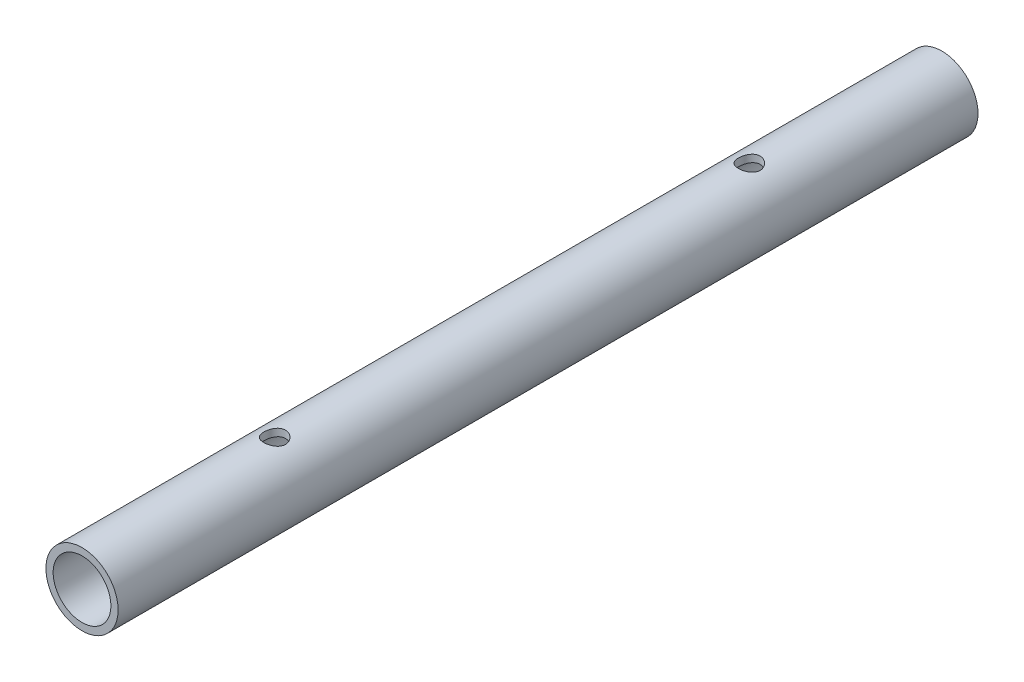
from build123d import *

# Parameters (mm, degrees)
SKETCH1_R               = 5
BOSS_EXTRUDE1_DEPTH     = 119.147
CUT_EXTRUDE1_REACH      = 121.357
SKETCH2_R               = 4
CUT_EXTRUDE2_DEPTH      = 120.356640406
CUT_EXTRUDE2_DEPTH_BACK = 120.356640406
SKETCH5_R               = 1.5


with BuildPart() as part:
    # Sketch1 → Boss-Extrude1 (new body)
    with BuildSketch(Plane.XY):
        Circle(SKETCH1_R)
    extrude(amount=BOSS_EXTRUDE1_DEPTH)

    # Sketch2 → Cut-Extrude1 (cut, up to next)
    with BuildSketch(Plane.XY.offset(119.147), mode=Mode.PRIVATE) as cut_extrude1_sk1:
        Circle(SKETCH2_R)
    cut_extrude1_tool1 = extrude(cut_extrude1_sk1.sketch, amount=-CUT_EXTRUDE1_REACH, mode=Mode.PRIVATE) & part.part
    add(cut_extrude1_tool1.solids().sort_by_distance((0, 0, 119.147))[0], mode=Mode.SUBTRACT)

    # Sketch5 → Cut-Extrude2 (cut, two sides: drawn at the far end of the back side and taken through both)
    with BuildSketch(Plane(origin=(0, 0, 0), x_dir=(1, 0, 0), z_dir=(0, 1, 0)).offset(-CUT_EXTRUDE2_DEPTH_BACK)):
        with Locations(Location((0, -26.689, 0), (0, 0, 270))):
            Circle(SKETCH5_R)
        with Locations(Location((0, -92.458, 0), (0, 0, 270))):
            Circle(SKETCH5_R)
    extrude(amount=CUT_EXTRUDE2_DEPTH + CUT_EXTRUDE2_DEPTH_BACK, mode=Mode.SUBTRACT)


solid = part.part
